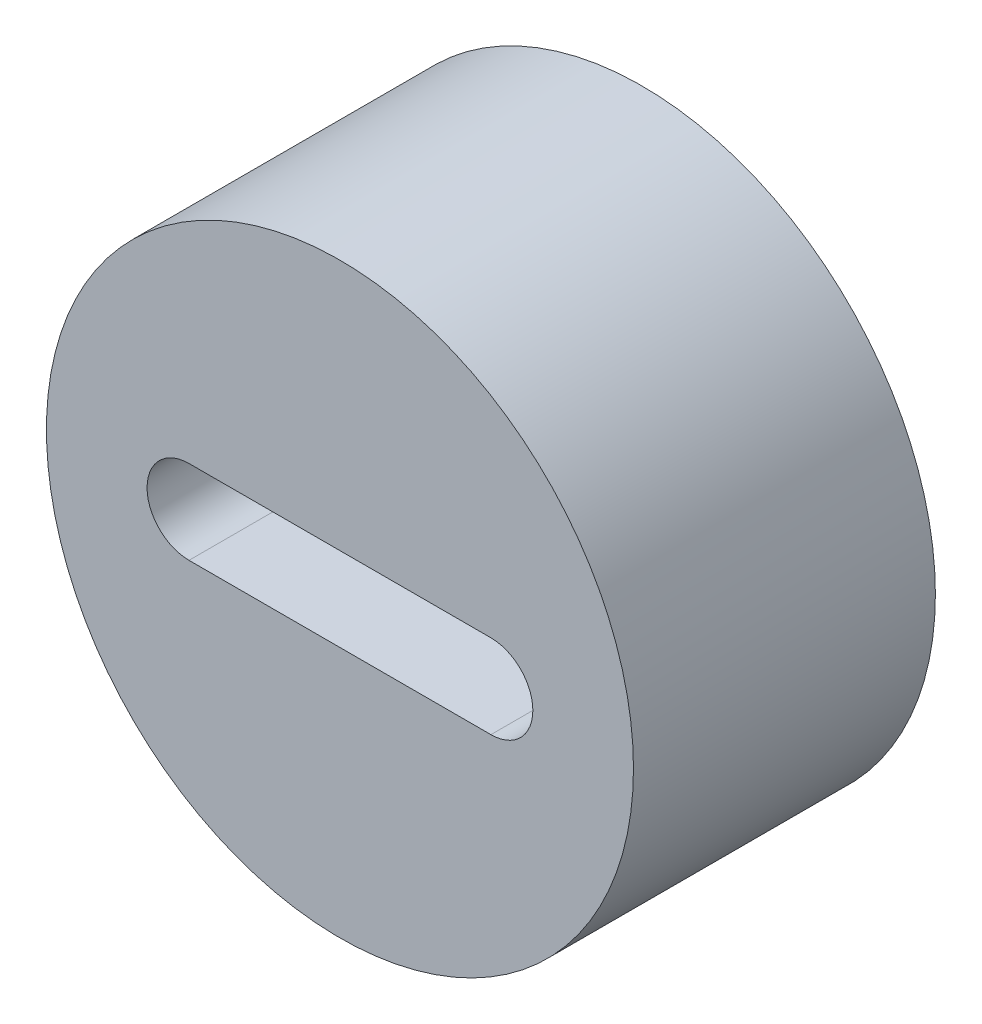
from build123d import *

# Parameters (mm, degrees)
SCHIZZO1_R                   = 17.5
ESTRUSIONE_ESTRUSIONE1_DEPTH = 18


with BuildPart() as part:
    # Schizzo1 → Estrusione-Estrusione1 (new body)
    with BuildSketch(Plane.XY):
        Circle(SCHIZZO1_R)
        with BuildLine():
            Line((-9, 2.5), (9, 2.5))
            ThreePointArc((9, 2.5), (11.5, 0), (9, -2.5))
            Line((9, -2.5), (-9, -2.5))
            ThreePointArc((-9, -2.5), (-11.5, 0), (-9, 2.5))
        make_face(mode=Mode.SUBTRACT)
    extrude(amount=ESTRUSIONE_ESTRUSIONE1_DEPTH)


solid = part.part
